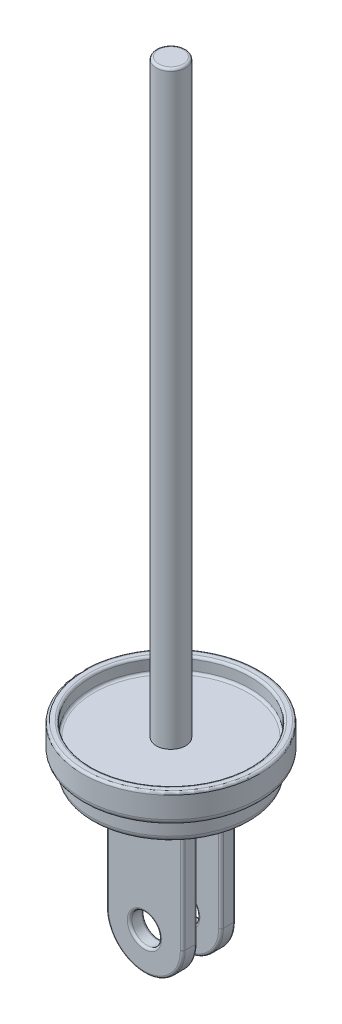
from build123d import *

# Parameters (mm, degrees)
SKETCH1_R                = 6.75
BOSS_EXTRUDE1_DEPTH      = 3
SKETCH2_R                = 1.25
BOSS_EXTRUDE2_DEPTH      = 50
BOSS_EXTRUDE3_START      = 1
SKETCH3_R                = 1.25
BOSS_EXTRUDE3_DEPTH      = 1.25
BOSS_EXTRUDE4_DEPTH      = 1.25
BOSS_EXTRUDE4_DEPTH_BACK = 1.25
SKETCH4_R                = 7.5
SKETCH4_R_2              = 6.75
FILLET1_R                = 0.5
FILLET2_R                = 0.2
FILLET3_R                = 0.2
FILLET4_R                = 0.2


with BuildPart() as part:
    # Sketch1 → Boss-Extrude1 (new body)
    with BuildSketch(Plane(origin=(0, 0, 0), x_dir=(1, 0, 0), z_dir=(0, 1, 0))):
        with Locations(Location((0, 0, 0), (0, 0, 270))):
            Circle(SKETCH1_R)
    extrude(amount=BOSS_EXTRUDE1_DEPTH)

    # Sketch2 → Boss-Extrude2 (add)
    with BuildSketch(Plane(origin=(0, 3, 0), x_dir=(1, 0, 0), z_dir=(0, 1, 0))):
        with Locations(Location((0, 0, 0), (0, 0, 270))):
            Circle(SKETCH2_R)
    extrude(amount=BOSS_EXTRUDE2_DEPTH)

    # Sketch3 → Boss-Extrude3 (add)
    with BuildSketch(Plane.XY.offset(BOSS_EXTRUDE3_START)):
        with BuildLine():
            Line((3.25, -10), (3.25, 0))
            Line((3.25, 0), (-3.25, 0))
            Line((-3.25, 0), (-3.25, -10))
            ThreePointArc((-3.25, -10), (0, -13.25), (3.25, -10))
        make_face()
        with Locations((0, -10)):
            Circle(SKETCH3_R, mode=Mode.SUBTRACT)
    boss_extrude3 = extrude(amount=BOSS_EXTRUDE3_DEPTH)

    # Mirror1: Boss-Extrude3 across plane
    add(boss_extrude3.mirror(Plane.XY))

    # Sketch4 → Boss-Extrude4 (add, two sides: drawn at the far end of the back side and taken through both)
    with BuildSketch(Plane(origin=(0, 3, 0), x_dir=(1, 0, 0), z_dir=(0, 1, 0)).offset(-BOSS_EXTRUDE4_DEPTH_BACK)):
        with Locations(Location((0, 0, 0), (0, 0, 270))):
            Circle(SKETCH4_R)
        with Locations(Location((0, 0, 0), (0, 0, 270))):
            Circle(SKETCH4_R_2, mode=Mode.SUBTRACT)
    extrude(amount=BOSS_EXTRUDE4_DEPTH + BOSS_EXTRUDE4_DEPTH_BACK)

    # Fillet1
    fillet1_edges = [part.edges().sort_by_distance(p)[0] for p in [
        (0, 0, -6.75),
        (0, 1.75, -7.5),
    ]]
    fillet(fillet1_edges, radius=FILLET1_R)

    # Fillet2
    fillet2_edges = [part.edges().sort_by_distance(p)[0] for p in [
        (0, -13.25, 2.25),
        (3.25, -5, 2.25),
        (0, 0, 2.25),
        (-3.25, -5, 2.25),
        (-1.25, -10, 1),
        (0, -13.25, 1),
        (3.25, -5, 1),
        (0, 0, 1),
        (3.25, 0, 1.625),
        (-3.25, -5, 1),
        (-3.25, 0, 1.625),
        (-1.25, -10, 2.25),
        (0, -13.25, -2.25),
        (-3.25, -5, -2.25),
        (0, 0, -2.25),
        (-3.25, 0, -1.625),
        (3.25, -5, -2.25),
        (3.25, 0, -1.625),
        (-1.25, -10, -2.25),
        (0, -13.25, -1),
        (3.25, -5, -1),
        (0, 0, -1),
        (-3.25, -5, -1),
        (-1.25, -10, -1),
    ]]
    fillet(fillet2_edges, radius=FILLET2_R)

    # Fillet3
    fillet3_edges = [part.edges().sort_by_distance(p)[0] for p in [
        (0, 3, -6.75),
        (0, 4.25, -6.75),
        (0, 4.25, -7.5),
    ]]
    fillet(fillet3_edges, radius=FILLET3_R)

    # Fillet4
    fillet4_edges = [part.edges().sort_by_distance(p)[0] for p in [
        (0, 53, -1.25),
    ]]
    fillet(fillet4_edges, radius=FILLET4_R)


solid = part.part
